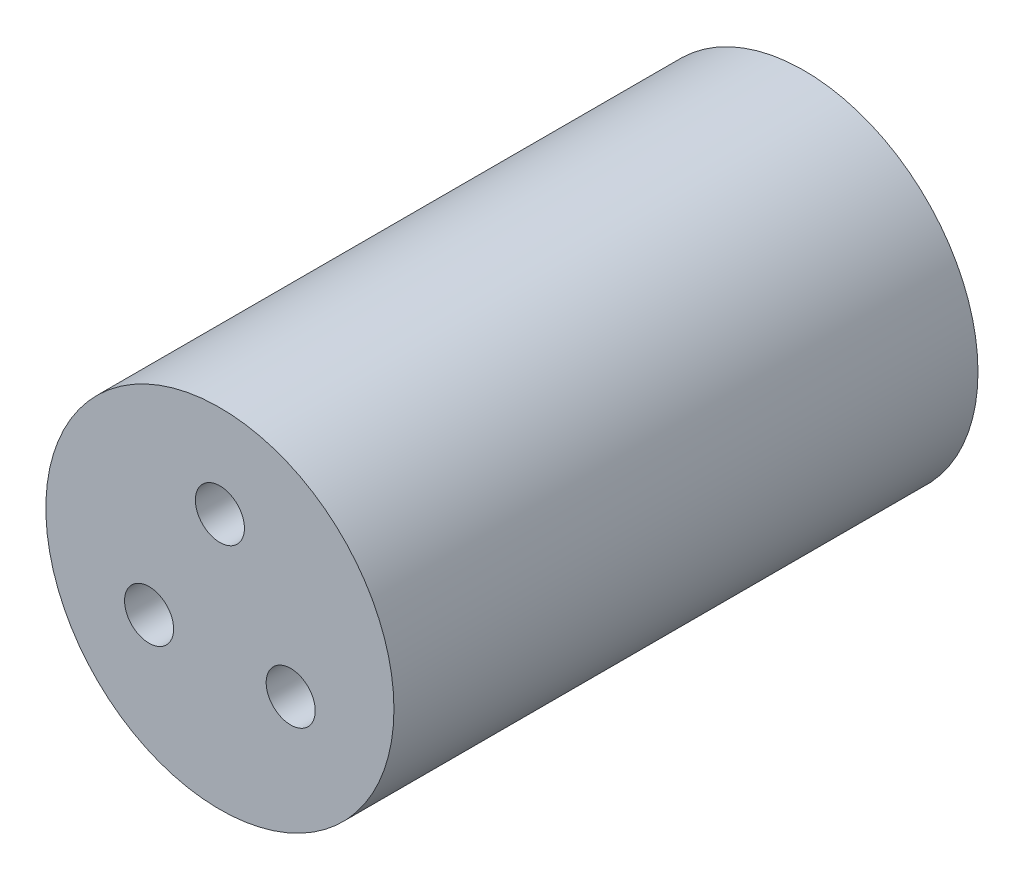
from build123d import *

# Parameters (mm, degrees)
SKETCH2_R           = 14.9
SKETCH2_R_2         = 1.7
BOSS_EXTRUDE1_DEPTH = 50
SKETCH3_R           = 2.1
CUT_EXTRUDE1_DEPTH  = 5.7


with BuildPart() as part:
    # Sketch2 → Boss-Extrude1 (new body)
    with BuildSketch(Plane.XY):
        Circle(SKETCH2_R)
        with Locations((0, 7)):
            Circle(SKETCH2_R_2, mode=Mode.SUBTRACT)
        with Locations((6.062177826, -3.5)):
            Circle(SKETCH2_R_2, mode=Mode.SUBTRACT)
        with Locations((-6.062177826, -3.5)):
            Circle(SKETCH2_R_2, mode=Mode.SUBTRACT)
    extrude(amount=BOSS_EXTRUDE1_DEPTH)

    # Sketch3 → Cut-Extrude1 (cut)
    with BuildSketch(Plane.XY.offset(50)):
        with Locations((0, 7)):
            Circle(SKETCH3_R)
        with Locations((6.062177826, -3.5)):
            Circle(SKETCH3_R)
        with Locations((-6.062177826, -3.5)):
            Circle(SKETCH3_R)
    cut_extrude1 = extrude(amount=-CUT_EXTRUDE1_DEPTH, mode=Mode.SUBTRACT)

    # Mirror1: Cut-Extrude1 across plane
    add(cut_extrude1.mirror(Plane.XY.offset(25)), mode=Mode.SUBTRACT)


solid = part.part
